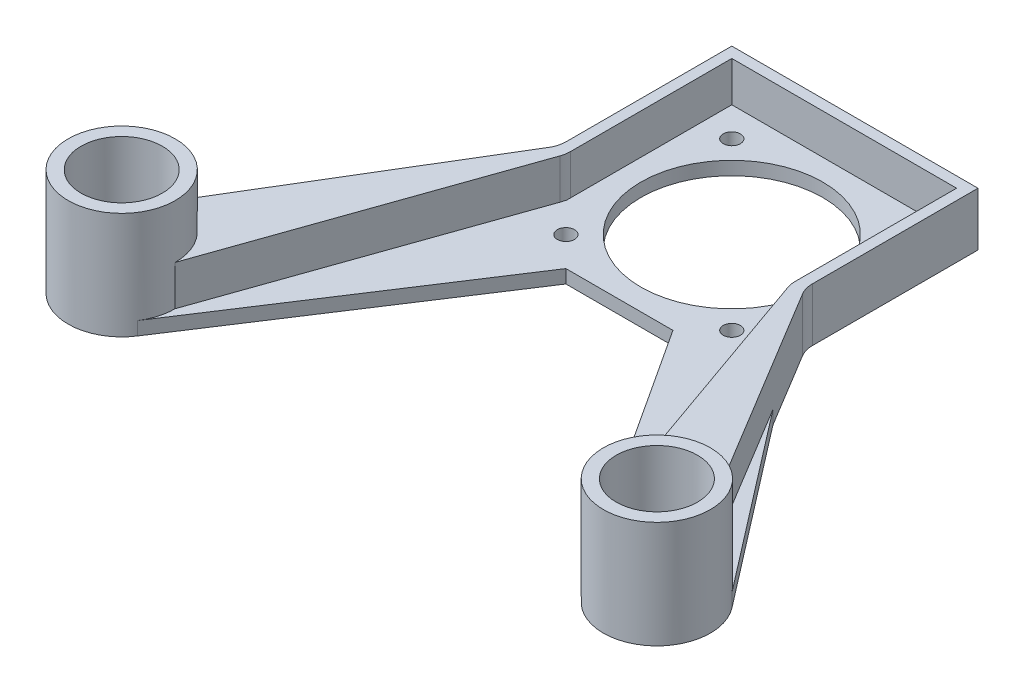
from build123d import *
from build123d.topology import SkipClean

# Parameters (mm, degrees)
SKETCH_6_W       = 42
SKETCH_6_H       = 42
SKETCH_6_R       = 1.6
SKETCH_6_R_2     = 17
EXTRUDE_1_DEPTH  = 2.5
SKETCH_7_R       = 7.6
EXTRUDE_5_DEPTH  = 2.5
EXTRUDE_START    = -20
SKETCH_9_R       = 10
SKETCH_9_R_2     = 7.6
EXTRUDE_7_DEPTH  = 20
EXTRUDE_START_2  = 10
EXTRUDE_11_DEPTH = 10


with BuildPart() as part:
    # 草图6 → 凸台-拉伸1 (new body)
    with BuildSketch(Plane(origin=(0, 0, 0), x_dir=(1, 0, 0), z_dir=(0, 1, 0))):
        Rectangle(SKETCH_6_W, SKETCH_6_H)
        with Locations(Location((15.5, 15.5, 0), (0, 0, 270))):
            Circle(SKETCH_6_R, mode=Mode.SUBTRACT)
        with Locations(Location((-15.5, 15.5, 0), (0, 0, 270))):
            Circle(SKETCH_6_R, mode=Mode.SUBTRACT)
        with Locations(Location((-15.5, -15.5, 0), (0, 0, 270))):
            Circle(SKETCH_6_R, mode=Mode.SUBTRACT)
        with Locations(Location((15.5, -15.5, 0), (0, 0, 270))):
            Circle(SKETCH_6_R, mode=Mode.SUBTRACT)
        with Locations(Location((0, 0, 0), (0, 0, 270))):
            Circle(SKETCH_6_R_2, mode=Mode.SUBTRACT)
    extrude(amount=EXTRUDE_1_DEPTH)

    # 草图7 → 凸台-拉伸5 (add)
    # profile 1 of 2: a face of its own
    with BuildSketch(Plane(origin=(0, 2.5, 0), x_dir=(1, 0, 0), z_dir=(0, 1, 0))):
        with BuildLine():
            Line((-21, -21), (-21, -10))
            Line((-21, -10), (-57.920014013, -57.894807289))
            ThreePointArc((-57.920014013, -57.894807289), (-55.789479543, -72.15364499), (-41.625301702, -69.464835626))
            Line((-41.625301702, -69.464835626), (-10, -21))
            Line((-10, -21), (-21, -21))
        make_face()
        with Locations(Location((-50, -64, 0), (0, 0, 270))):
            Circle(SKETCH_7_R, mode=Mode.SUBTRACT)
    # profile 2 of 2: a face of its own
    with BuildSketch(Plane(origin=(0, 2.5, 0), x_dir=(1, 0, 0), z_dir=(0, 1, 0))):
        with BuildLine():
            Line((57.920014013, -57.894807289), (21, -10))
            Line((21, -10), (21, -21))
            Line((21, -21), (10, -21))
            Line((10, -21), (41.625301702, -69.464835626))
            ThreePointArc((41.625301702, -69.464835626), (55.789479543, -72.15364499), (57.920014013, -57.894807289))
        make_face()
        with Locations(Location((50, -64, 0), (0, 0, 270))):
            Circle(SKETCH_7_R, mode=Mode.SUBTRACT)
    extrude(amount=-EXTRUDE_5_DEPTH)

    # 草图9 → 凸台-拉伸7 (add)
    # profile 1 of 2: a face of its own
    with SkipClean():  # the faces are left unmerged after this step: merging them gives an invalid solid
        with BuildSketch(Plane(origin=(0, 0, 0), x_dir=(-1, 0, 0), z_dir=(0, -1, 0)).offset(EXTRUDE_START)):
            with Locations(Location((50, -64, 0), (0, 0, 213.126103521))):
                Circle(SKETCH_9_R)
            with Locations(Location((50, -64, 0), (0, 0, 270))):
                Circle(SKETCH_9_R_2, mode=Mode.SUBTRACT)
        # profile 2 of 2: a face of its own
        with BuildSketch(Plane(origin=(0, 0, 0), x_dir=(-1, 0, 0), z_dir=(0, -1, 0)).offset(EXTRUDE_START)):
            with Locations(Location((-50, -64, 0), (0, 0, 326.873896479))):
                Circle(SKETCH_9_R)
            with Locations(Location((-50, -64, 0), (0, 0, 270))):
                Circle(SKETCH_9_R_2, mode=Mode.SUBTRACT)
        extrude(amount=EXTRUDE_7_DEPTH)

    # 草图10 → 凸台-拉伸11 (add)
    with SkipClean():  # the faces are left unmerged after this step: merging them gives an invalid solid
        with BuildSketch(Plane(origin=(0, 0, 0), x_dir=(1, 0, 0), z_dir=(0, 1, 0)).offset(EXTRUDE_START_2)):
            with BuildLine():
                Line((-50, -54), (-23.720634175, -10.511170428))
                ThreePointArc((-23.720634175, -10.511170428), (-23.18352675, -9.267473069), (-23, -7.925241555))
                Line((-23, -7.925241555), (-23, 23))
                Line((-23, 23), (0, 23))
                Line((0, 23), (23, 23))
                Line((23, 23), (23, -7.925241555))
                ThreePointArc((23, -7.925241555), (23.18352675, -9.267473069), (23.720634175, -10.511170428))
                Line((23.720634175, -10.511170428), (50, -54))
                ThreePointArc((50, -54), (42.928932188, -56.928932188), (40, -64))
                Line((40, -64), (21.283438046, -10.805560762))
                ThreePointArc((21.283438046, -10.805560762), (21.071368863, -9.987810622), (21, -9.146029704))
                Line((21, -9.146029704), (21, 21))
                Line((21, 21), (-21, 21))
                Line((-21, 21), (-21, -9.146029704))
                ThreePointArc((-21, -9.146029704), (-21.071368863, -9.987810622), (-21.283438046, -10.805560762))
                Line((-21.283438046, -10.805560762), (-40, -64))
                ThreePointArc((-40, -64), (-42.928932188, -56.928932188), (-50, -54))
            make_face()
        extrude(amount=-EXTRUDE_11_DEPTH)


solid = part.part
